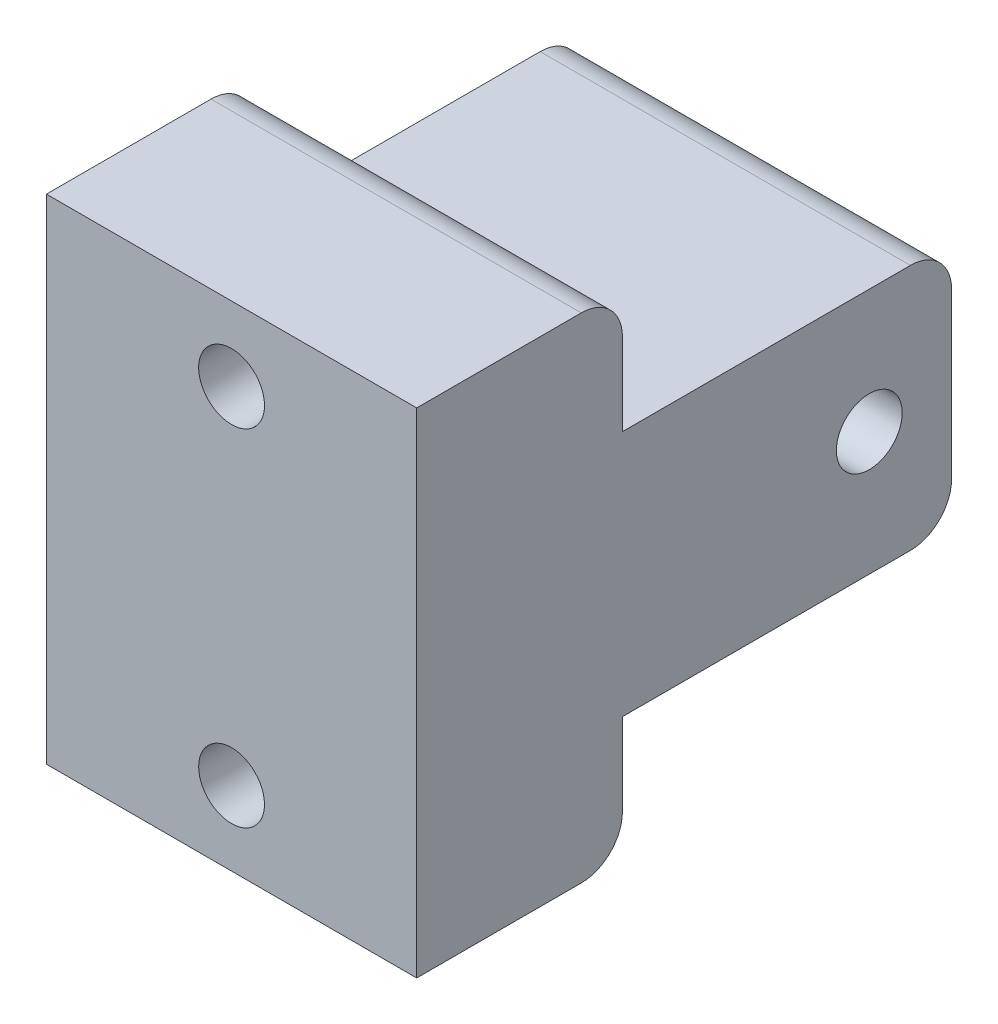
from build123d import *

# Parameters (mm, degrees)
SKETCH_1_R          = 4
EXTRUDE_1_DEPTH     = 45
SKETCH_2_R          = 4
CUT_EXTRUDE_1_DEPTH = 45


with BuildPart() as part:
    # 草图1 → 凸台-拉伸1 (new body)
    with BuildSketch(Plane(origin=(0, 0, 0), x_dir=(0, 0, -1), z_dir=(1, 0, 0))):
        with BuildLine():
            Line((-20, 15), (15, 15))
            ThreePointArc((15, 15), (18.535533906, 13.535533906), (20, 10))
            Line((20, 10), (20, -10))
            ThreePointArc((20, -10), (18.535533906, -13.535533906), (15, -15))
            Line((15, -15), (-20, -15))
            Line((-20, -15), (-20, -25))
            ThreePointArc((-20, -25), (-21.464466094, -28.535533906), (-25, -30))
            Line((-25, -30), (-45, -30))
            Line((-45, -30), (-45, 30))
            Line((-45, 30), (-25, 30))
            ThreePointArc((-25, 30), (-21.464466094, 28.535533906), (-20, 25))
            Line((-20, 25), (-20, 15))
        make_face()
        with Locations(Location((10, 0, 0), (0, 0, 180))):
            Circle(SKETCH_1_R, mode=Mode.SUBTRACT)
    extrude(amount=EXTRUDE_1_DEPTH)

    # 草图2 → 切除-拉伸1 (cut)
    with BuildSketch(Plane.XY.offset(45)):
        with Locations((22.5, 21)):
            Circle(SKETCH_2_R)
        with Locations(Location((22.5, -21, 0), (0, 0, 270))):
            Circle(SKETCH_2_R)
    extrude(amount=-CUT_EXTRUDE_1_DEPTH, mode=Mode.SUBTRACT)


solid = part.part
